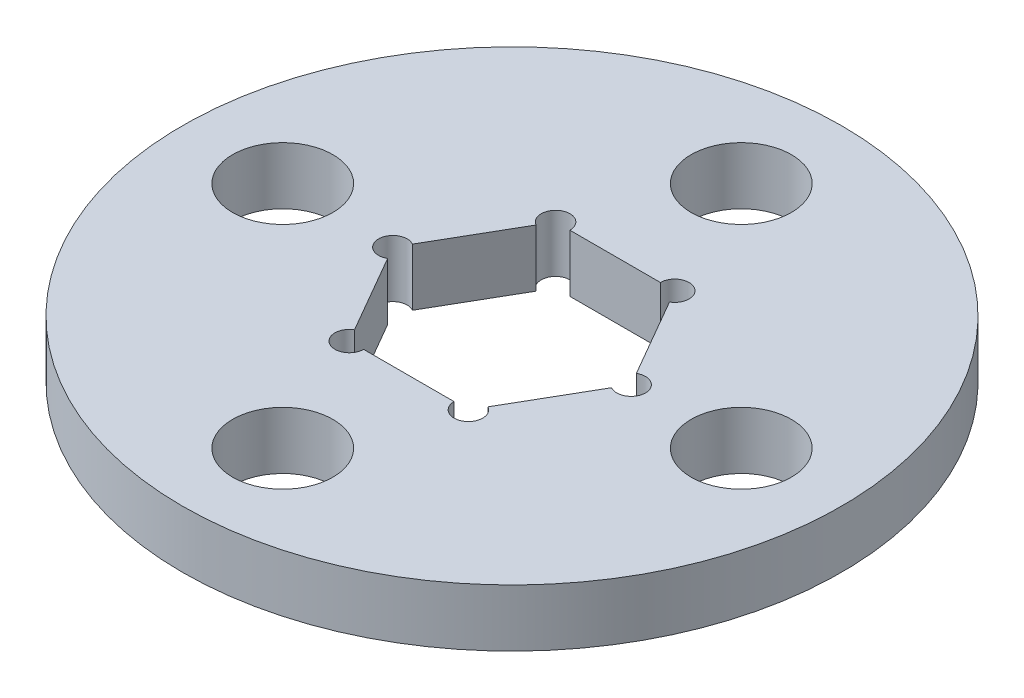
from build123d import *

# Parameters (mm, degrees)
SKETCH1_R               = 11.5
SKETCH1_R_2             = 1.75
BOSS_EXTRUDE1_DEPTH     = 2
CUT_EXTRUDE1_DEPTH      = 17.385969608
CUT_EXTRUDE1_DEPTH_BACK = 17.385969608
SKETCH2_R               = 0.5


with BuildPart() as part:
    # Sketch1 → Boss-Extrude1 (new body)
    with BuildSketch(Plane(origin=(0, 0, 0), x_dir=(1, 0, 0), z_dir=(0, 1, 0))):
        with Locations(Location((0, 0, 0), (0, 0, 270))):
            Circle(SKETCH1_R)
        with Locations(Location((0, 8, 0), (0, 0, 270))):
            Circle(SKETCH1_R_2, mode=Mode.SUBTRACT)
        with Locations(Location((8, 0, 0), (0, 0, 270))):
            Circle(SKETCH1_R_2, mode=Mode.SUBTRACT)
        with Locations(Location((0, -8, 0), (0, 0, 270))):
            Circle(SKETCH1_R_2, mode=Mode.SUBTRACT)
        with Locations(Location((-8, 0, 0), (0, 0, 270))):
            Circle(SKETCH1_R_2, mode=Mode.SUBTRACT)
        Polygon((2.078460969, 3.6), (-2.078460969, 3.6), (-4.156921938, 0), (-2.078460969, -3.6), (2.078460969, -3.6), (4.156921938, 0), align=None, mode=Mode.SUBTRACT)
    extrude(amount=BOSS_EXTRUDE1_DEPTH)

    # Sketch2 → Cut-Extrude1 (cut, two sides: drawn at the far end of the back side and taken through both)
    with BuildSketch(Plane.XZ.offset(-CUT_EXTRUDE1_DEPTH_BACK)):
        with Locations((-2.078460969, 3.6)):
            Circle(SKETCH2_R)
        with Locations((2.078460969, 3.6)):
            Circle(SKETCH2_R)
        with Locations((4.156921938, 0)):
            Circle(SKETCH2_R)
        with Locations((2.078460969, -3.6)):
            Circle(SKETCH2_R)
        with Locations((-2.078460969, -3.6)):
            Circle(SKETCH2_R)
        with Locations((-4.156921938, 0)):
            Circle(SKETCH2_R)
    extrude(amount=CUT_EXTRUDE1_DEPTH + CUT_EXTRUDE1_DEPTH_BACK, mode=Mode.SUBTRACT)


solid = part.part
